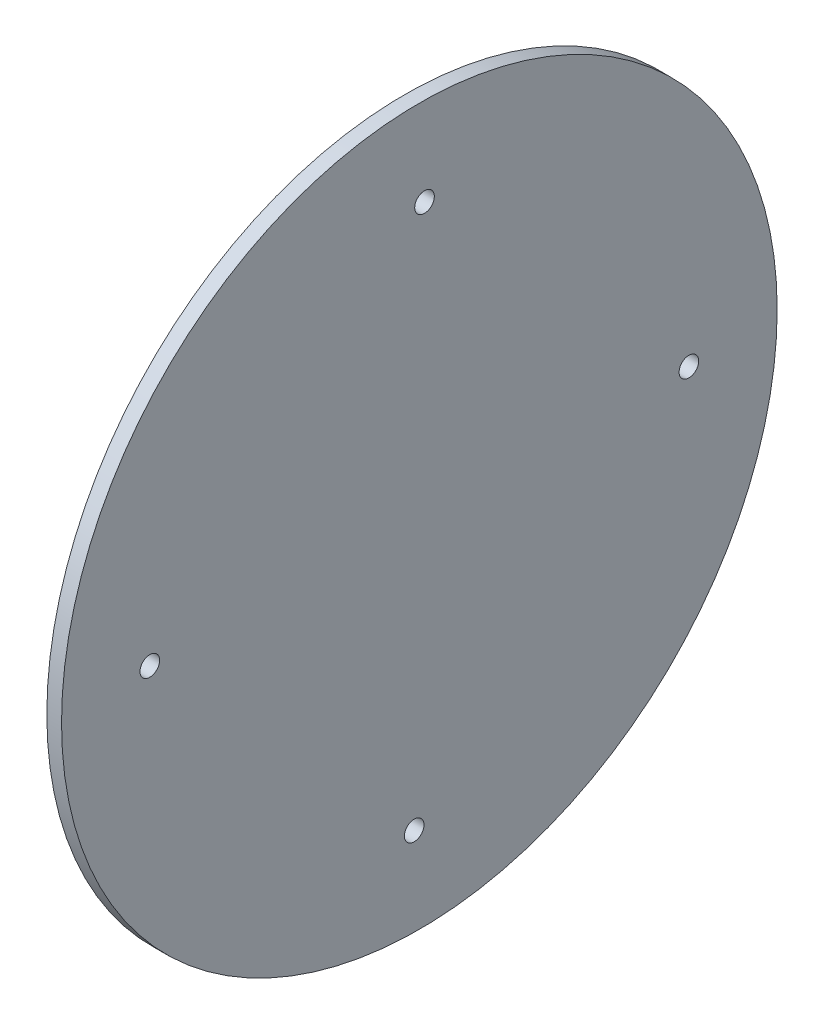
from build123d import *
from build123d.topology import SkipClean

# Parameters (mm, degrees)
SKETCH1_R           = 36.5
BOSS_EXTRUDE1_DEPTH = 2
SKETCH2_R           = 1
CUT_EXTRUDE1_DEPTH  = 82.563170228
SKETCH3_R           = 36.5
SKETCH3_R_2         = 35
CUT_EXTRUDE2_DEPTH  = 0.5
SKETCH4_R           = 35.5
SKETCH4_R_2         = 35
CUT_EXTRUDE3_DEPTH  = 0.25


with BuildPart() as part:
    # Sketch1 → Boss-Extrude1 (new body)
    with BuildSketch(Plane(origin=(0, 0, 0), x_dir=(0, 0, -1), z_dir=(1, 0, 0))):
        with Locations((-28.542888787, 18.957113921)):
            Circle(SKETCH1_R)
    extrude(amount=BOSS_EXTRUDE1_DEPTH)

    # Sketch2 → Cut-Extrude1 (cut, through all)
    with BuildSketch(Plane(origin=(-11.5, 40.326440474, 9.173024085), x_dir=(0, -0.9998166429303736, 0.019148903870400247), z_dir=(-1, 0, 0))):
        with Locations(Location((21.736320014, 46.457113921, 0), (0, 0, 88.902781564))):
            Circle(SKETCH2_R)
        with Locations(Location((21.736320014, -8.542886079, 0), (0, 0, 88.902781564))):
            Circle(SKETCH2_R)
        with Locations(Location((49.236320014, 18.957113921, 0), (0, 0, 88.902781564))):
            Circle(SKETCH2_R)
        with Locations(Location((-5.763679986, 18.957113921, 0), (0, 0, 88.902781564))):
            Circle(SKETCH2_R)
    extrude(amount=-CUT_EXTRUDE1_DEPTH, mode=Mode.SUBTRACT)

    # Sketch3 → Cut-Extrude2 (cut)
    with BuildSketch(Plane(origin=(0, 0, 0), x_dir=(0, 0, -1), z_dir=(1, 0, 0))):
        with Locations((-28.542888787, 18.957113921)):
            Circle(SKETCH3_R)
        with Locations((-28.542888787, 18.957113921)):
            Circle(SKETCH3_R_2, mode=Mode.SUBTRACT)
    extrude(amount=CUT_EXTRUDE2_DEPTH, mode=Mode.SUBTRACT)

    # Sketch4 → Cut-Extrude3 (cut)
    with SkipClean():  # the faces are left unmerged after this step: merging them gives an invalid solid
        with BuildSketch(Plane.ZY.offset(-0.5)):
            with Locations((28.542888787, 18.957113921)):
                Circle(SKETCH4_R)
            with Locations((28.542888787, 18.957113921)):
                Circle(SKETCH4_R_2, mode=Mode.SUBTRACT)
        extrude(amount=-CUT_EXTRUDE3_DEPTH, mode=Mode.SUBTRACT)


solid = part.part
